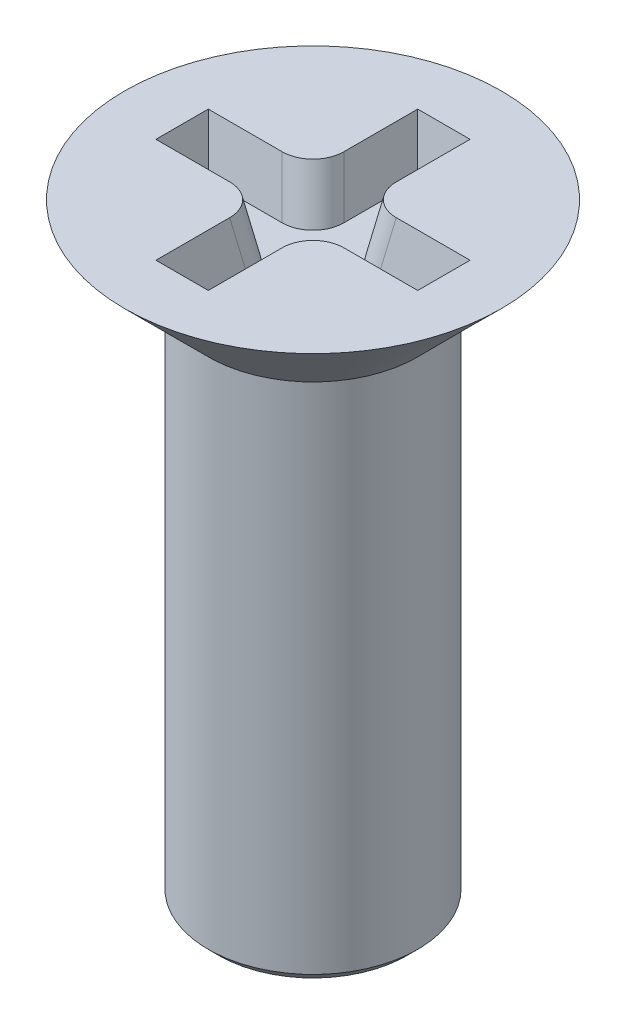
from build123d import *

# Parameters (mm, degrees)
SKETCH_2_R                    = 1
EXTRUDE_1_DEPTH               = 5
SKETCH_3_W                    = 2.5
SKETCH_3_H                    = 0.5
CUT_EXTRUDE_1_DEPTH           = 0.5
CUT_EXTRUDE_1_DRAFT           = -10
SKETCH_3_W_2                  = 0.5
SKETCH_3_H_2                  = 2.5
CUT_EXTRUDE_1_PROFILE_2_DEPTH = 0.5
CUT_EXTRUDE_1_PROFILE_2_DRAFT = -10
FILLET_1_R                    = 0.3
CHAMFER_2_SIZE                = 0.1


with BuildPart() as part:
    # 草图1 → 旋转1 (revolve)
    with BuildSketch(Plane.XY, mode=Mode.PRIVATE) as revolve_1_sk:
        Polygon((0, 0), (1.8, 0), (1, -0.8), (0, -0.8), align=None)
    revolve(revolve_1_sk.sketch.rotate(Axis((0, -0.8, 0), (0, 1, 0)), 90), axis=Axis((0, -0.8, 0), (0, 1, 0)))

    # 草图2 → 凸台-拉伸1 (add)
    with BuildSketch(Plane.XZ.offset(0.8)):
        with Locations(Location((0, 0, 0), (0, 0, 270))):
            Circle(SKETCH_2_R)
    extrude(amount=EXTRUDE_1_DEPTH)


with BuildPart() as cut_extrude_1_tool:
    # 草图3 → 切除-拉伸1 (with draft: the straight prism first)
    with BuildSketch(Plane(origin=(0, 0, 0), x_dir=(1, 0, 0), z_dir=(0, 1, 0))):
        Rectangle(SKETCH_3_W, SKETCH_3_H)
    extrude(amount=-CUT_EXTRUDE_1_DEPTH)
    # 切除-拉伸1: the draft: its side faces are tilted about the plane it starts from
    cut_extrude_1_sides = [cut_extrude_1_tool.faces().sort_by_distance(p)[0] for p in [
        (0, -0.25, 0.25),
        (1.25, -0.25, 0),
        (0, -0.25, -0.25),
        (-1.25, -0.25, 0),
    ]]
    draft(cut_extrude_1_sides, Plane(origin=(0, 0, 0), x_dir=(1, 0, 0), z_dir=(0, 1, 0)), CUT_EXTRUDE_1_DRAFT)


with BuildPart() as part_1:
    add(part.part)

    # 切除-拉伸1: cut by cut_extrude_1_tool
    add(cut_extrude_1_tool.part, mode=Mode.SUBTRACT)


with BuildPart() as cut_extrude_1_profile_2_tool:
    # 草图3 → 切除-拉伸1 profile 2 (with draft: the straight prism first)
    with BuildSketch(Plane(origin=(0, 0, 0), x_dir=(1, 0, 0), z_dir=(0, 1, 0))):
        Rectangle(SKETCH_3_W_2, SKETCH_3_H_2)
    extrude(amount=-CUT_EXTRUDE_1_PROFILE_2_DEPTH)
    # 切除-拉伸1 profile 2: the draft: its side faces are tilted about the plane it starts from
    cut_extrude_1_profile_2_sides = [cut_extrude_1_profile_2_tool.faces().sort_by_distance(p)[0] for p in [
        (-0.25, -0.25, 0),
        (0, -0.25, 1.25),
        (0.25, -0.25, 0),
        (0, -0.25, -1.25),
    ]]
    draft(cut_extrude_1_profile_2_sides, Plane(origin=(0, 0, 0), x_dir=(1, 0, 0), z_dir=(0, 1, 0)), CUT_EXTRUDE_1_PROFILE_2_DRAFT)


with BuildPart() as part_2:
    add(part_1.part)

    # 切除-拉伸1 profile 2: cut by cut_extrude_1_profile_2_tool
    add(cut_extrude_1_profile_2_tool.part, mode=Mode.SUBTRACT)

    # 圆角1
    fillet_1_edges = [part_2.edges().sort_by_distance(p)[0] for p in [
        (0.205918255, -0.25, -0.205918255),
        (0.205918255, -0.25, 0.205918255),
        (-0.205918255, -0.25, 0.205918255),
        (-0.205918255, -0.25, -0.205918255),
    ]]
    fillet(fillet_1_edges, radius=FILLET_1_R)

    # 倒角2
    chamfer_2_edges = [part_2.edges().sort_by_distance(p)[0] for p in [
        (0, -5.8, 1),
    ]]
    chamfer(chamfer_2_edges, length=CHAMFER_2_SIZE)


solid = part_2.part
